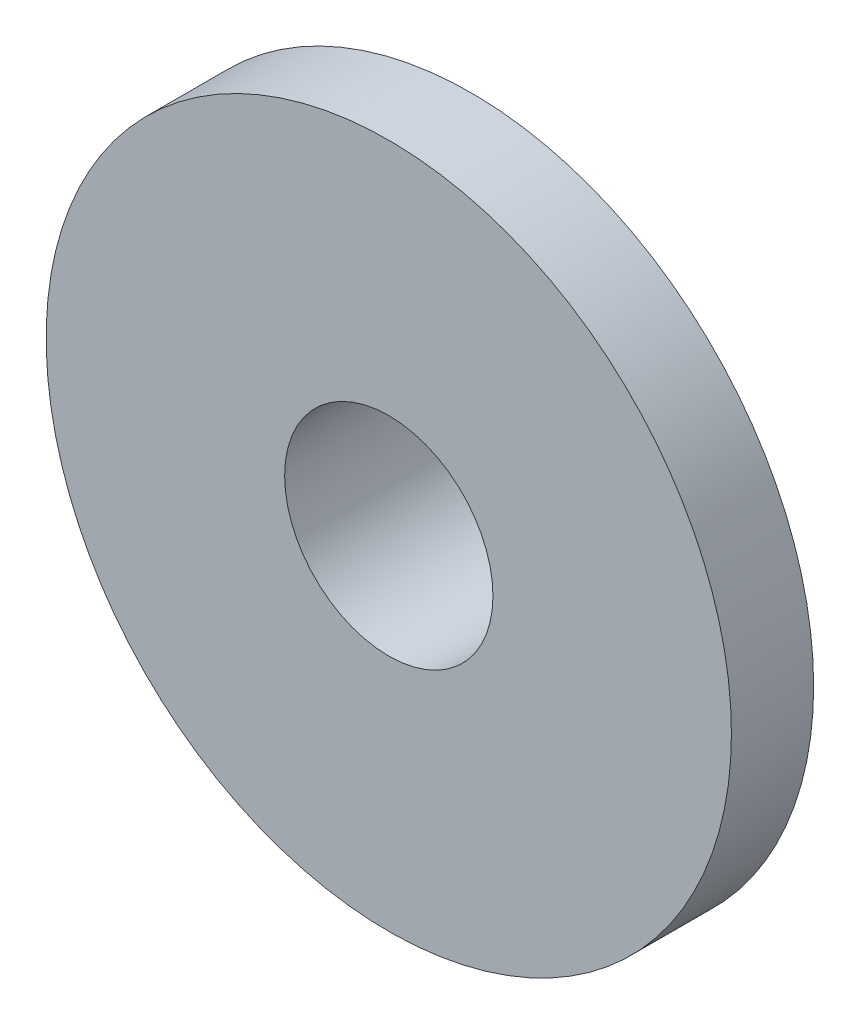
from build123d import *

# Parameters (mm, degrees)
ESQUISSE1_R             = 11.5
BOSS_EXTRU_1_DEPTH      = 13
ESQUISSE2_R             = 25
ESQUISSE2_R_2           = 7.5
BOSS_EXTRU_2_DEPTH      = 6
ESQUISSE5_R             = 7.6
ENL_V_MAT_EXTRU_1_DEPTH = 38.669616404


with BuildPart() as part:
    # Esquisse1 → Boss.-Extru.1 (new body)
    with BuildSketch(Plane.XY):
        with Locations(Location((0, 0, 0), (0, 0, 180))):
            Circle(ESQUISSE1_R)
    extrude(amount=BOSS_EXTRU_1_DEPTH)

    # Esquisse2 → Boss.-Extru.2 (add)
    with BuildSketch(Plane.XY.offset(13)):
        Circle(ESQUISSE2_R)
        Circle(ESQUISSE2_R_2, mode=Mode.SUBTRACT)
    extrude(amount=-BOSS_EXTRU_2_DEPTH)

    # Esquisse5 → Enlèv. mat.-Extru.1 (cut, through all)
    with BuildSketch(Plane.XY.offset(13)):
        Circle(ESQUISSE5_R)
    extrude(amount=-ENL_V_MAT_EXTRU_1_DEPTH, mode=Mode.SUBTRACT)


solid = part.part
